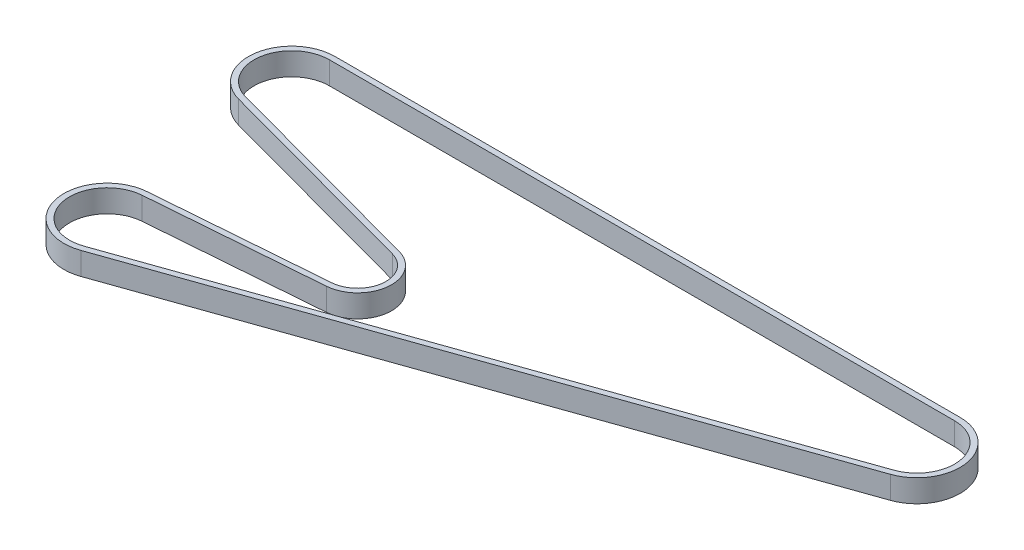
from build123d import *

# Parameters (mm, degrees)
EXTRUDE_1_DEPTH = 12


with BuildPart() as part:
    # 草图2 → 拉伸-薄壁1 (new body)
    with BuildSketch(Plane(origin=(0, 0, 0), x_dir=(1, 0, 0), z_dir=(0, 1, 0))):
        with BuildLine():
            Line((237.640587425, 45.306189274), (-80.359412575, -66.693810726))
            ThreePointArc((-80.359412575, -66.693810726), (-110.502587258, -49.757474822), (-89.793723849, -22.070051139))
            Line((-89.793723849, -22.070051139), (1.169819902, -14.954314474))
            ThreePointArc((1.169819902, -14.954314474), (14.934850756, -1.396507396), (3.921954796, 14.478199839))
            Line((3.921954796, 14.478199839), (-108.013664021, 44.80009358))
            ThreePointArc((-108.013664021, 44.80009358), (-124.799099189, 70.033327574), (-102, 90))
            Line((-102, 90), (230, 90))
            ThreePointArc((230, 90), (252.671101062, 70.875716277), (237.640587425, 45.306189274))
        make_face()
        with BuildLine():
            Line((236.643989066, 48.13581676), (-81.356010934, -63.86418324))
            ThreePointArc((-81.356010934, -63.86418324), (-107.567467181, -49.136934628), (-89.559759869, -25.060914034))
            Line((-89.559759869, -25.060914034), (1.403783882, -17.945177369))
            ThreePointArc((1.403783882, -17.945177369), (17.921820907, -1.675808875), (4.706345755, 17.373839807))
            Line((4.706345755, 17.373839807), (-107.229273062, 47.695733548))
            ThreePointArc((-107.229273062, 47.695733548), (-121.825303643, 69.637676152), (-102, 87))
            Line((-102, 87), (230, 87))
            ThreePointArc((230, 87), (249.714000923, 70.370188067), (236.643989066, 48.13581676))
        make_face(mode=Mode.SUBTRACT)
    extrude(amount=EXTRUDE_1_DEPTH)


solid = part.part
